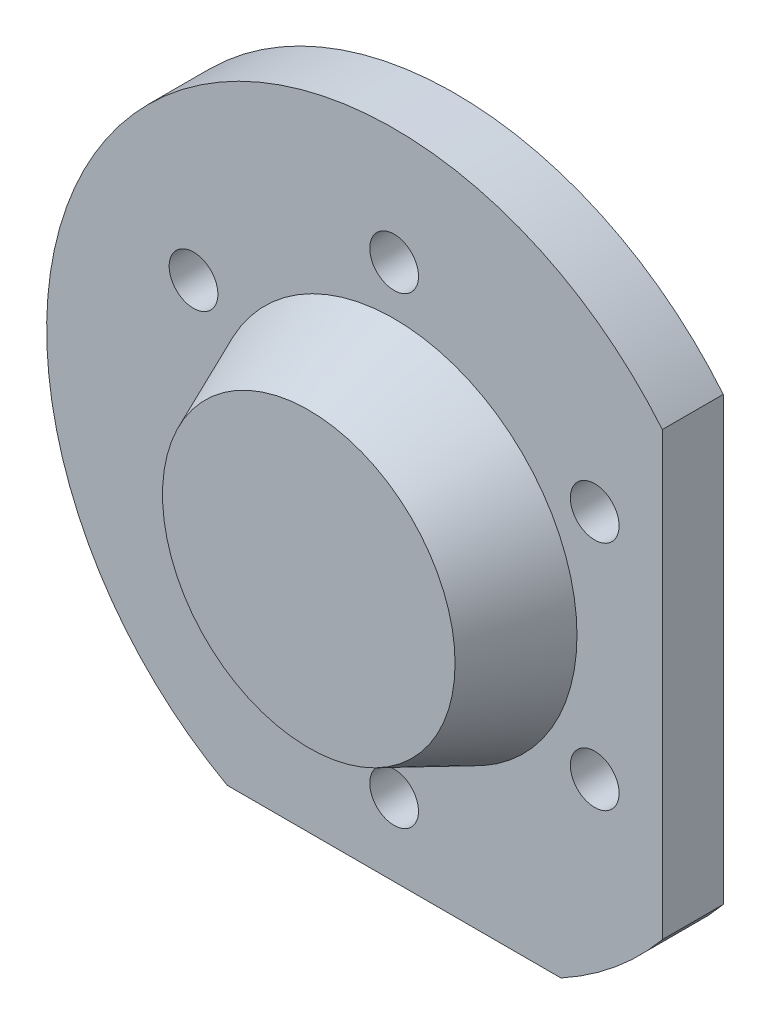
from build123d import *

# Parameters (mm, degrees)
SKETCH1_R           = 15
SKETCH1_R_2         = 2
BOSS_EXTRUDE1_DEPTH = 5
SKETCH1_2_R         = 15
BOSS_EXTRUDE2_DEPTH = 6
SKETCH2_R           = 12
SKETCH1_4_R         = 15


with BuildPart() as part:
    # Sketch1 → Boss-Extrude1 (new body)
    with BuildSketch(Plane.XY):
        with BuildLine():
            Line((22, -18.117670932), (22, 18.117670932))
            ThreePointArc((22, 18.117670932), (-21.956152501, 18.170783345), (-13.683932183, -25))
            Line((-13.683932183, -25), (13.683932183, -25))
            ThreePointArc((13.683932183, -25), (18.170783345, -21.956152501), (22, -18.117670932))
        make_face()
        Circle(SKETCH1_R, mode=Mode.SUBTRACT)
        with Locations((0, 19)):
            Circle(SKETCH1_R_2, mode=Mode.SUBTRACT)
        with Locations((16.454482672, 9.5)):
            Circle(SKETCH1_R_2, mode=Mode.SUBTRACT)
        with Locations((16.454482672, -9.5)):
            Circle(SKETCH1_R_2, mode=Mode.SUBTRACT)
        with Locations((0, -19)):
            Circle(SKETCH1_R_2, mode=Mode.SUBTRACT)
        with Locations((-16.454482672, -9.5)):
            Circle(SKETCH1_R_2, mode=Mode.SUBTRACT)
        with Locations((-16.454482672, 9.5)):
            Circle(SKETCH1_R_2, mode=Mode.SUBTRACT)
    extrude(amount=-BOSS_EXTRUDE1_DEPTH)

    # Sketch1<2> → Boss-Extrude2 (add)
    with BuildSketch(Plane.XY):
        Circle(SKETCH1_2_R)
    extrude(amount=-BOSS_EXTRUDE2_DEPTH)

    # Sketch2 → Loft1 section 0
    with BuildSketch(Plane.XY.offset(7)):
        Circle(SKETCH2_R)
    # Sketch1<4> → Loft1 section 1
    with BuildSketch(Plane.XY):
        Circle(SKETCH1_4_R)
    loft()


solid = part.part
